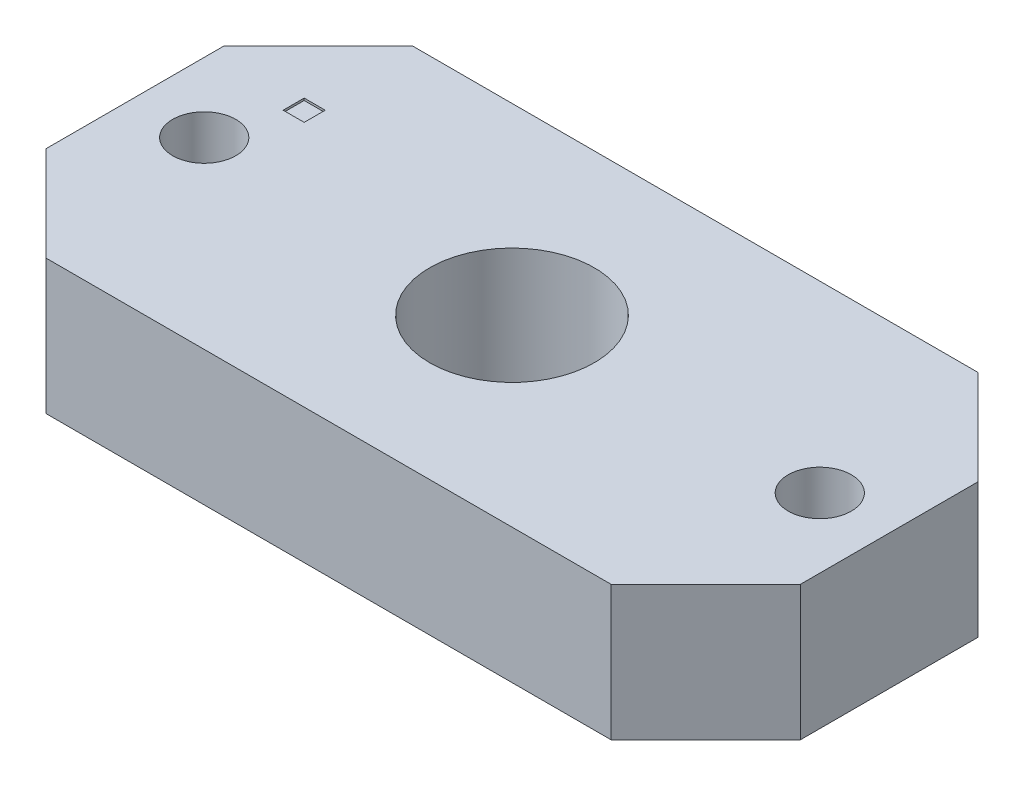
from build123d import *

# Parameters (mm, degrees)
SKETCH1_R           = 3.9125
SKETCH1_R_2         = 1.5
BOSS_EXTRUDE1_DEPTH = 6.4
SKETCH2_W           = 1
SKETCH2_H           = 1
CUT_EXTRUDE1_DEPTH  = 0.1


with BuildPart() as part:
    # Sketch1 → Boss-Extrude1 (new body)
    with BuildSketch(Plane(origin=(0, 0, 0), x_dir=(1, 0, 0), z_dir=(0, 1, 0))):
        Polygon((102.49610132, 15.883489834), (106.99610132, 11.383489834), (106.99610132, 2.946691354), (102.49610132, -1.553308646), (75.64610132, -1.553308646), (71.14610132, 2.946691354), (71.14610132, 11.383489834), (75.64610132, 15.883489834), align=None)
        with Locations(Location((89.07110132, 7.165090594, 0), (0, 0, 270))):
            Circle(SKETCH1_R, mode=Mode.SUBTRACT)
        with Locations(Location((74.44610132, 7.165090594, 0), (0, 0, 270))):
            Circle(SKETCH1_R_2, mode=Mode.SUBTRACT)
        with Locations(Location((103.69610132, 7.165090594, 0), (0, 0, 90))):
            Circle(SKETCH1_R_2, mode=Mode.SUBTRACT)
    extrude(amount=BOSS_EXTRUDE1_DEPTH)

    # Sketch2 → Cut-Extrude1 (cut)
    with BuildSketch(Plane(origin=(0, 6.4, 0), x_dir=(1, 0, 0), z_dir=(0, 1, 0))):
        with Locations((75.696023721, 10.665090594)):
            Rectangle(SKETCH2_W, SKETCH2_H)
    extrude(amount=-CUT_EXTRUDE1_DEPTH, mode=Mode.SUBTRACT)


solid = part.part
